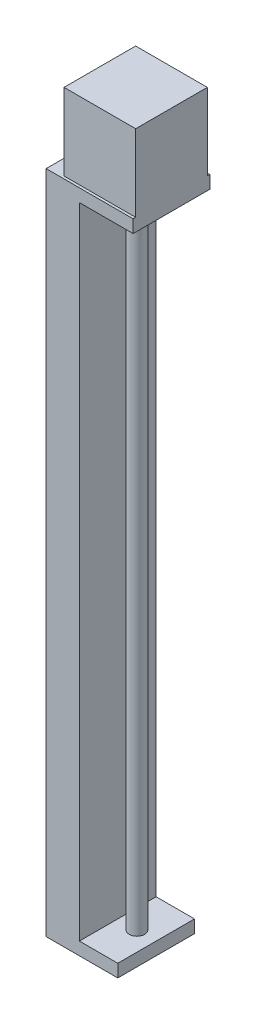
from build123d import *

# Parameters (mm, degrees)
SKETCH1_W           = 34
SKETCH1_H           = 5
SKETCH1_W_2         = 13
SKETCH1_H_2         = 250
BOSS_EXTRUDE1_DEPTH = 15
SKETCH1_3_W         = 28
SKETCH1_3_H         = 30
BOSS_EXTRUDE2_DEPTH = 14
SKETCH2_R           = 3
BOSS_EXTRUDE3_DEPTH = 250


with BuildPart() as part:
    # Sketch1 → Boss-Extrude1 (new, symmetric)
    with BuildSketch(Plane.XY):
        with Locations((0, 127.5)):
            Rectangle(SKETCH1_W, SKETCH1_H)
        with Locations((-10.5, 0)):
            Rectangle(SKETCH1_W_2, SKETCH1_H_2)
        Polygon((-4, -125), (-17, -125), (-17, -130), (11, -130), (11, -125), align=None)
    extrude(amount=BOSS_EXTRUDE1_DEPTH, both=True)

    # Sketch1<3> → Boss-Extrude2 (add, symmetric)
    with BuildSketch(Plane.XY):
        with Locations((3, 145)):
            Rectangle(SKETCH1_3_W, SKETCH1_3_H)
    extrude(amount=BOSS_EXTRUDE2_DEPTH, both=True)

    # Sketch2 → Boss-Extrude3 (add)
    with BuildSketch(Plane(origin=(0, -125, 0), x_dir=(1, 0, 0), z_dir=(0, 1, 0))):
        with Locations(Location((3.5, 0, 0), (0, 0, 90))):
            Circle(SKETCH2_R)
    extrude(amount=BOSS_EXTRUDE3_DEPTH)


solid = part.part
